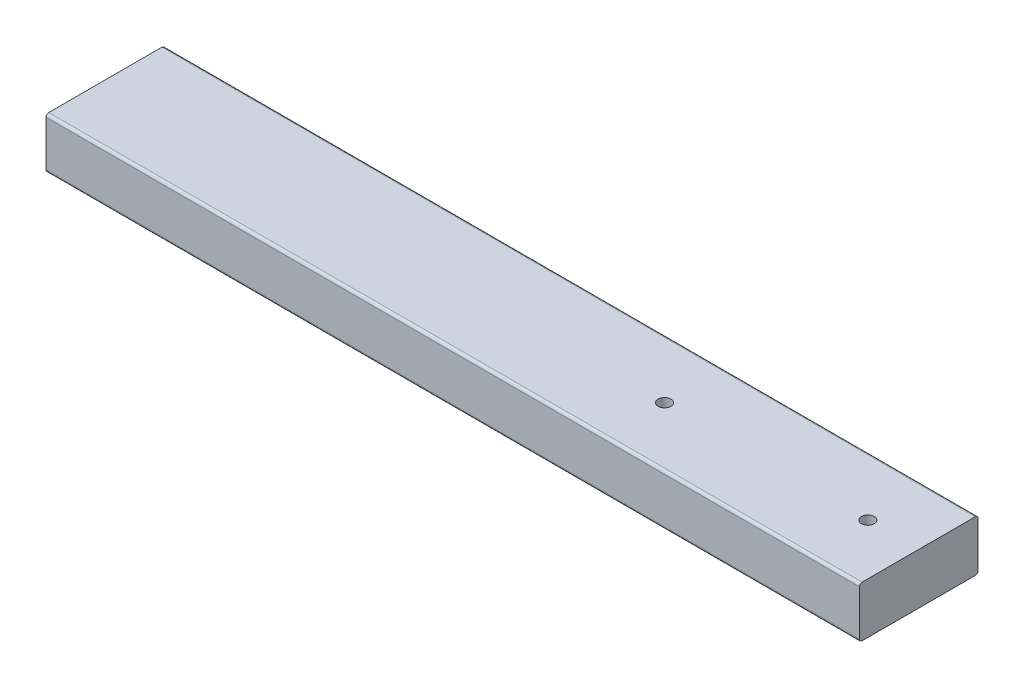
from build123d import *

# Parameters (mm, degrees)
SKETCH1_W           = 88.9
SKETCH1_H           = 38.1
BOSS_EXTRUDE1_DEPTH = 609.6
FILLET1_R           = 2
SKETCH2_R           = 4.7625
CUT_EXTRUDE1_DEPTH  = 613.404745654


with BuildPart() as part:
    # Sketch1 → Boss-Extrude1 (new body)
    with BuildSketch(Plane(origin=(0, 609.6, 0), x_dir=(0, 0, -1), z_dir=(1, 0, 0))):
        with Locations((0, -609.6)):
            Rectangle(SKETCH1_W, SKETCH1_H)
    extrude(amount=BOSS_EXTRUDE1_DEPTH)

    # Fillet1
    fillet1_edges = [part.edges().sort_by_distance(p)[0] for p in [
        (304.8, -19.05, -44.45),
        (304.8, -19.05, 44.45),
        (304.8, 19.05, 44.45),
        (304.8, 19.05, -44.45),
    ]]
    fillet(fillet1_edges, radius=FILLET1_R)

    # Sketch2 → Cut-Extrude1 (cut, through all)
    with BuildSketch(Plane(origin=(0, -19.05, 0), x_dir=(-1, 0, 0), z_dir=(0, -1, 0))):
        with Locations(Location((-419.1, 0, 0), (0, 0, 90))):
            Circle(SKETCH2_R)
        with Locations(Location((-571.5, 0, 0), (0, 0, 90))):
            Circle(SKETCH2_R)
    extrude(amount=-CUT_EXTRUDE1_DEPTH, mode=Mode.SUBTRACT)


solid = part.part
